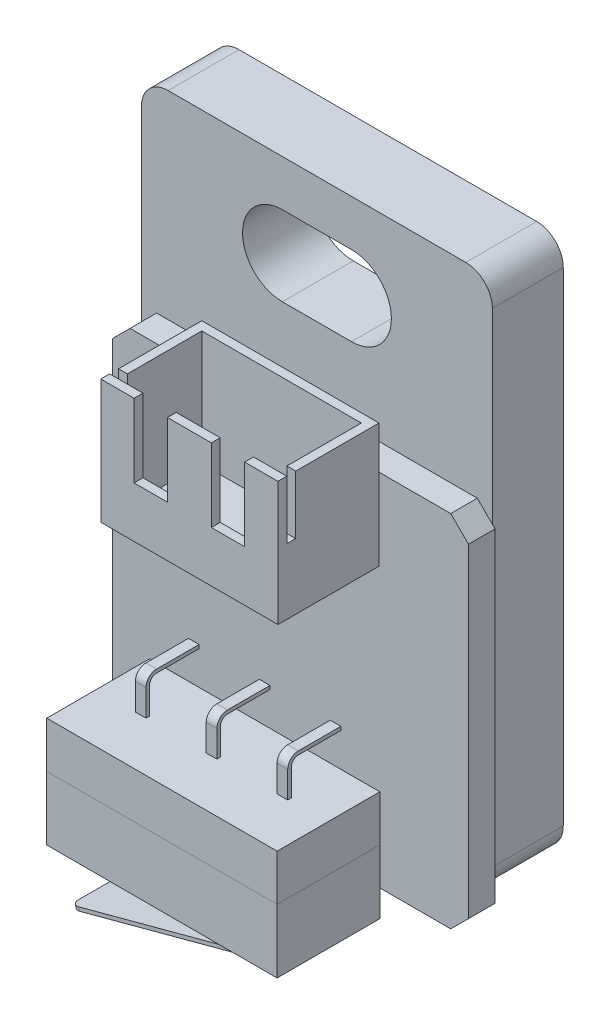
from build123d import *

# Parameters (mm, degrees)
SKETCH1_W              = 19.8
SKETCH1_H              = 30.3
BOSS_EXTRUDE1_DEPTH    = 4
FILLET1_R              = 1.5
CUT_EXTRUDE1_DEPTH     = 19.534629751
SKETCH3_W              = 20.1
SKETCH3_H              = 20.3
BOSS_EXTRUDE2_DEPTH    = 1.5
SKETCH4_W              = 13
SKETCH4_H              = 6.2
BOSS_EXTRUDE3_DEPTH    = 5.8
SKETCH5_W              = 10
SKETCH5_H              = 7
BOSS_EXTRUDE4_DEPTH    = 5.7
SHELL1_T               = -0.5
SKETCH6_W              = 1.880298236
SKETCH6_H              = 4.137248564
CUT_EXTRUDE2_DEPTH     = 0.5
SPLIT1_SURFACE_1_BACK  = 41.258
SPLIT1_SURFACE_1_DEPTH = 82.516
SPLIT1_SURFACE_2_BACK  = 41.258
SPLIT1_SURFACE_2_DEPTH = 82.516
EXTRUDE_THIN1_DEPTH    = 1.8
FILLET2_R              = 0.5
CUT_EXTRUDE3_DEPTH     = 39.088254585
SKETCH11_W             = 1.5
SKETCH11_H             = 3.6
BOSS_EXTRUDE5_DEPTH    = 0.6
EXTRUDE_THIN2_DEPTH    = 0.3
LPATTERN1_COUNT        = 2
LPATTERN1_PITCH        = 4
LPATTERN1_2_COUNT      = 2
LPATTERN1_2_PITCH      = 4
EXTRUDE_THIN3_DEPTH    = 0.25
LPATTERN2_COUNT        = 2
LPATTERN2_PITCH        = 3
LPATTERN2_2_COUNT      = 2
LPATTERN2_2_PITCH      = 3
CHAMFER1_SIZE          = 1
SKETCH16_W             = 0.5
SKETCH16_H             = 3.3
CUT_EXTRUDE4_DEPTH     = 29.49115272


with BuildPart() as part:
    # Sketch1 → Boss-Extrude1 (new body)
    with BuildSketch(Plane.XY):
        Rectangle(SKETCH1_W, SKETCH1_H)
    extrude(amount=BOSS_EXTRUDE1_DEPTH)

    # Fillet1
    fillet1_edges = [part.edges().sort_by_distance(p)[0] for p in [
        (9.9, -15.15, 2),
        (-9.9, -15.15, 2),
        (-9.9, 15.15, 2),
        (9.9, 15.15, 2),
    ]]
    fillet(fillet1_edges, radius=FILLET1_R)

    # Sketch2 → Cut-Extrude1 (cut, through all)
    with BuildSketch(Plane.XY.offset(4)):
        with BuildLine():
            Line((-1.95, 12.55), (1.95, 12.55))
            ThreePointArc((1.95, 12.55), (4.2, 10.3), (1.95, 8.05))
            Line((1.95, 8.05), (-1.95, 8.05))
            ThreePointArc((-1.95, 8.05), (-4.2, 10.3), (-1.95, 12.55))
        make_face()
    extrude(amount=-CUT_EXTRUDE1_DEPTH, mode=Mode.SUBTRACT)


with BuildPart() as body_2:
    # Sketch3 → Boss-Extrude2 (new body)
    with BuildSketch(Plane.XY.offset(4)):
        with Locations((0, -6.2)):
            Rectangle(SKETCH3_W, SKETCH3_H)
    extrude(amount=BOSS_EXTRUDE2_DEPTH)

    # Chamfer1
    chamfer1_edges = [body_2.edges().sort_by_distance(p)[0] for p in [
        (10.05, -16.35, 4.75),
        (-10.05, -16.35, 4.75),
        (-10.05, 3.95, 4.75),
        (10.05, 3.95, 4.75),
    ]]
    chamfer(chamfer1_edges, length=CHAMFER1_SIZE)


with BuildPart() as body_3:
    # Sketch4 → Boss-Extrude3 (new body)
    with BuildSketch(Plane.XY.offset(5.5)):
        with Locations((-1.45, -14.75)):
            Rectangle(SKETCH4_W, SKETCH4_H)
    extrude(amount=BOSS_EXTRUDE3_DEPTH)


with BuildPart() as body_4:
    # Sketch5 → Boss-Extrude4 (new body)
    with BuildSketch(Plane.XY.offset(5.5)):
        with Locations((0, 2.85)):
            Rectangle(SKETCH5_W, SKETCH5_H)
    extrude(amount=BOSS_EXTRUDE4_DEPTH)

    # Shell1
    shell1_openings = [body_4.faces().sort_by_distance(p)[0] for p in [
        (0, 6.35, 8.35),
    ]]
    offset(amount=SHELL1_T, openings=shell1_openings, kind=Kind.INTERSECTION)

    # Sketch6 → Cut-Extrude2 (cut)
    with BuildSketch(Plane.XY.offset(11.2)):
        with Locations((2.179965006, 4.281375718)):
            Rectangle(SKETCH6_W, SKETCH6_H)
        with Locations((-2.179965006, 4.281375718)):
            Rectangle(SKETCH6_W, SKETCH6_H)
    extrude(amount=-CUT_EXTRUDE2_DEPTH, mode=Mode.SUBTRACT)

    # Sketch16 → Cut-Extrude4 (cut, through all)
    with BuildSketch(Plane(origin=(5, 0, 0), x_dir=(0, 0, -1), z_dir=(1, 0, 0))):
        with Locations((-10.45, 4.7)):
            Rectangle(SKETCH16_W, SKETCH16_H)
    extrude(amount=-CUT_EXTRUDE4_DEPTH, mode=Mode.SUBTRACT)


with BuildPart() as body_5:
    # Split1: the piece behind the surface
    add(body_3.part)
    # Split1 surface: a surface, the sketch's curves swept straight by 82.516 mm
    with BuildLine(Plane.XY.offset(11.3).offset(-SPLIT1_SURFACE_1_BACK), mode=Mode.PRIVATE) as split1_surface_1_path:
        Line((-7.95, -14.25), (5.05, -14.25))
    split1_surface_1 = Shell.extrude(split1_surface_1_path.wire(), (0 * SPLIT1_SURFACE_1_DEPTH, 0 * SPLIT1_SURFACE_1_DEPTH, 1 * SPLIT1_SURFACE_1_DEPTH))
    split(bisect_by=split1_surface_1, keep=Keep.BOTTOM)


with BuildPart() as body_3_1:
    add(body_3.part)

    # Split1: split by a surface, the side it looks to stays
    # Split1 surface: a surface, the sketch's curves swept straight by 82.516 mm
    with BuildLine(Plane.XY.offset(11.3).offset(-SPLIT1_SURFACE_2_BACK), mode=Mode.PRIVATE) as split1_surface_2_path:
        Line((-7.95, -14.25), (5.05, -14.25))
    split1_surface_2 = Shell.extrude(split1_surface_2_path.wire(), (0 * SPLIT1_SURFACE_2_DEPTH, 0 * SPLIT1_SURFACE_2_DEPTH, 1 * SPLIT1_SURFACE_2_DEPTH))
    split(bisect_by=split1_surface_2, keep=Keep.TOP)


with BuildPart() as body_6:
    # Sketch8 → Extrude-Thin1 (new, symmetric)
    with BuildSketch(Plane(origin=(0, 0, 8.4), x_dir=(-1, 0, 0), z_dir=(0, 0, -1))):
        with BuildLine():
            ThreePointArc((-4.05, -17.85), (-3.998338335, -18.002190357), (-3.864704761, -18.091481457))
            Line((-3.864704761, -18.091481457), (7.726405154, -21.197309998))
            Line((7.726405154, -21.197309998), (7.674641345, -21.390495163))
            Line((7.674641345, -21.390495163), (-3.91646857, -18.284666622))
            ThreePointArc((-3.91646857, -18.284666622), (-4.157009003, -18.123942643), (-4.25, -17.85))
            Line((-4.25, -17.85), (-4.05, -17.85))
        make_face()
    extrude(amount=EXTRUDE_THIN1_DEPTH, both=True)

    # Fillet2
    fillet2_edges = [body_6.edges().sort_by_distance(p)[0] for p in [
        (-7.70052325, -21.29390258, 6.6),
        (-7.70052325, -21.29390258, 10.2),
    ]]
    fillet(fillet2_edges, radius=FILLET2_R)

    # Sketch10 → Cut-Extrude3 (cut, through all)
    with BuildSketch(Plane(origin=(4.833520303, -18.038943351, 0), x_dir=(0.9659258262890701, 0.2588190451025141, 0), z_dir=(0.2588190451025141, -0.9659258262890701, 0))):
        with BuildLine():
            Line((-0.949401815, 8.4), (-8.139735193, 8.4))
            ThreePointArc((-8.139735193, 8.4), (-8.254161068, 8.130322182), (-8.527607862, 8.025221006))
            Line((-8.527607862, 8.025221006), (-0.949401815, 7.76492965))
            Line((-0.949401815, 7.76492965), (-0.949401815, 8.4))
        make_face()
        Polygon((-0.949401815, 9.03507035), (-0.949401815, 8.4), (-0.949401815, 7.76492965), (-0.514735193, 7.75), (-0.514735193, 9.05), align=None)
        with BuildLine():
            ThreePointArc((-8.527607862, 8.774778994), (-8.254161068, 8.669677818), (-8.139735193, 8.4))
            Line((-8.139735193, 8.4), (-0.949401815, 8.4))
            Line((-0.949401815, 8.4), (-0.949401815, 9.03507035))
            Line((-0.949401815, 9.03507035), (-8.527607862, 8.774778994))
        make_face()
        with BuildLine():
            ThreePointArc((-8.527607862, 8.025221006), (-8.254161068, 8.130322182), (-8.139735193, 8.4))
            Line((-8.139735193, 8.4), (-8.889735193, 8.4))
            ThreePointArc((-8.889735193, 8.4), (-8.784413011, 8.139425875), (-8.527607862, 8.025221006))
        make_face()
        with BuildLine():
            Line((-8.889735193, 8.4), (-8.139735193, 8.4))
            ThreePointArc((-8.139735193, 8.4), (-8.254161068, 8.669677818), (-8.527607862, 8.774778994))
            ThreePointArc((-8.527607862, 8.774778994), (-8.784413011, 8.660574125), (-8.889735193, 8.4))
        make_face()
    extrude(amount=-CUT_EXTRUDE3_DEPTH, mode=Mode.SUBTRACT)


with BuildPart() as body_7:
    # Sketch11 → Boss-Extrude5 (new body)
    with BuildSketch(Plane.XZ.offset(17.85)):
        with Locations((1.8, 8.4)):
            Rectangle(SKETCH11_W, SKETCH11_H)
    extrude(amount=BOSS_EXTRUDE5_DEPTH)


with BuildPart() as body_8:
    # Sketch12 → Extrude-Thin2 (new, symmetric)
    with BuildSketch(Plane(origin=(-1.45, 0, 0), x_dir=(0, 0, -1), z_dir=(1, 0, 0))):
        with BuildLine():
            Line((-8.3, -11.65), (-8.3, -10.15))
            ThreePointArc((-8.3, -10.15), (-8.182842712, -9.867157288), (-7.9, -9.75))
            Line((-7.9, -9.75), (-5.5, -9.75))
            Line((-5.5, -9.75), (-5.5, -9.55))
            Line((-5.5, -9.55), (-7.9, -9.55))
            ThreePointArc((-7.9, -9.55), (-8.324264069, -9.725735931), (-8.5, -10.15))
            Line((-8.5, -10.15), (-8.5, -11.65))
            Line((-8.5, -11.65), (-8.3, -11.65))
        make_face()
    extrude(amount=EXTRUDE_THIN2_DEPTH, both=True)


with BuildPart() as lpattern1_1:
    # LPattern1: pattern copy
    add(body_8.part.moved(Location(Vector(1, 0, 0) * (1 * LPATTERN1_PITCH))))


with BuildPart() as lpattern1_2_1:
    # LPattern1 2: pattern copy
    add(body_8.part.moved(Location(Vector(-1, 0, 0) * (1 * LPATTERN1_2_PITCH))))


with BuildPart() as body_11:
    # Sketch14 → Extrude-Thin3 (new, symmetric)
    with BuildSketch(Plane(origin=(0, 0, 0), x_dir=(0, 0, -1), z_dir=(1, 0, 0))):
        with BuildLine():
            Line((-8.6, -0.65), (-8.6, -0.9))
            ThreePointArc((-8.6, -0.9), (-8.497487373, -1.147487373), (-8.25, -1.25))
            Line((-8.25, -1.25), (-5.5, -1.25))
            Line((-5.5, -1.25), (-5.5, -1.05))
            Line((-5.5, -1.05), (-8.25, -1.05))
            ThreePointArc((-8.25, -1.05), (-8.356066017, -1.006066017), (-8.4, -0.9))
            Line((-8.4, -0.9), (-8.4, -0.65))
            Line((-8.4, -0.65), (-8.6, -0.65))
        make_face()
    extrude(amount=EXTRUDE_THIN3_DEPTH, both=True)


with BuildPart() as lpattern2_1:
    # LPattern2: pattern copy
    add(body_11.part.moved(Location(Vector(-1, 0, 0) * (1 * LPATTERN2_PITCH))))


with BuildPart() as lpattern2_2_1:
    # LPattern2 2: pattern copy
    add(body_11.part.moved(Location(Vector(1, 0, 0) * (1 * LPATTERN2_2_PITCH))))


solid = Compound([part.part, body_2.part, body_4.part, body_5.part, body_3_1.part, body_6.part, body_7.part, body_8.part, lpattern1_1.part, lpattern1_2_1.part, body_11.part, lpattern2_1.part, lpattern2_2_1.part])
